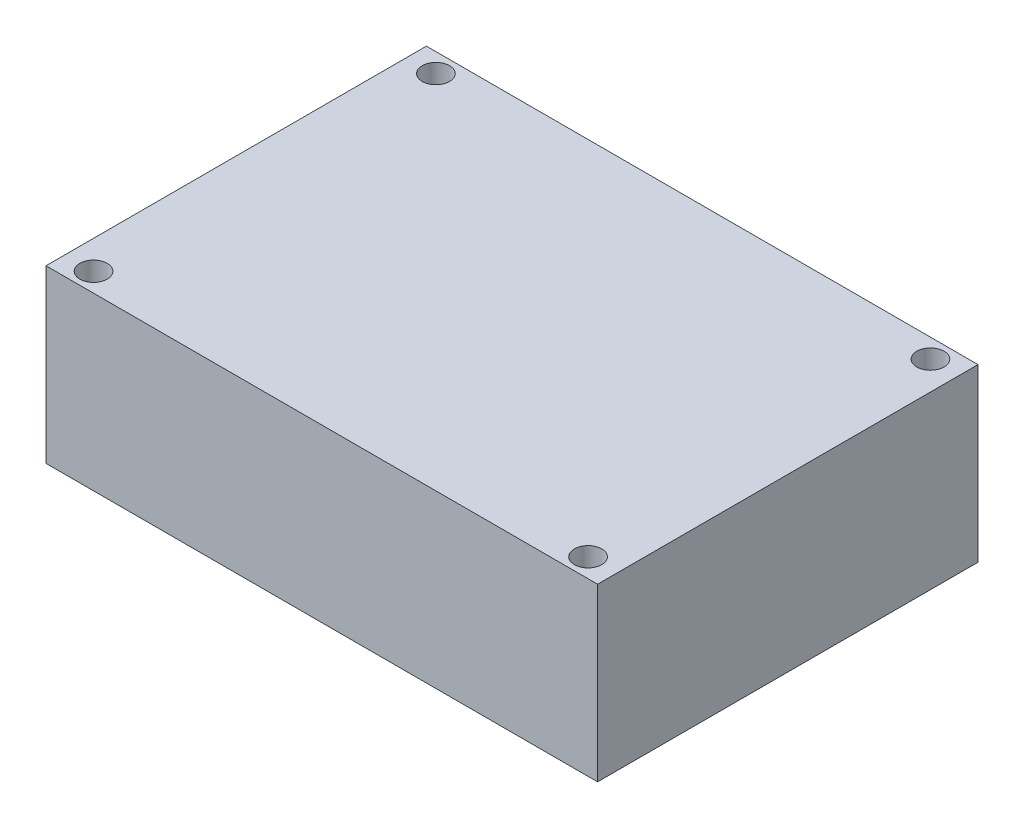
from build123d import *

# Parameters (mm, degrees)
SKETCH1_W           = 73.66
SKETCH1_H           = 50.8
SKETCH1_R           = 1.8288
BOSS_EXTRUDE1_DEPTH = 11.43


with BuildPart() as part:
    # Sketch1 → Boss-Extrude1 (new, symmetric)
    with BuildSketch(Plane(origin=(0, 0, 0), x_dir=(1, 0, 0), z_dir=(0, 1, 0))):
        Rectangle(SKETCH1_W, SKETCH1_H)
        with Locations(Location((-33.02, 22.86, 0), (0, 0, 270))):
            Circle(SKETCH1_R, mode=Mode.SUBTRACT)
        with Locations(Location((33.02, 22.86, 0), (0, 0, 270))):
            Circle(SKETCH1_R, mode=Mode.SUBTRACT)
        with Locations(Location((33.02, -22.86, 0), (0, 0, 270))):
            Circle(SKETCH1_R, mode=Mode.SUBTRACT)
        with Locations(Location((-33.02, -22.86, 0), (0, 0, 270))):
            Circle(SKETCH1_R, mode=Mode.SUBTRACT)
    extrude(amount=BOSS_EXTRUDE1_DEPTH, both=True)


solid = part.part
